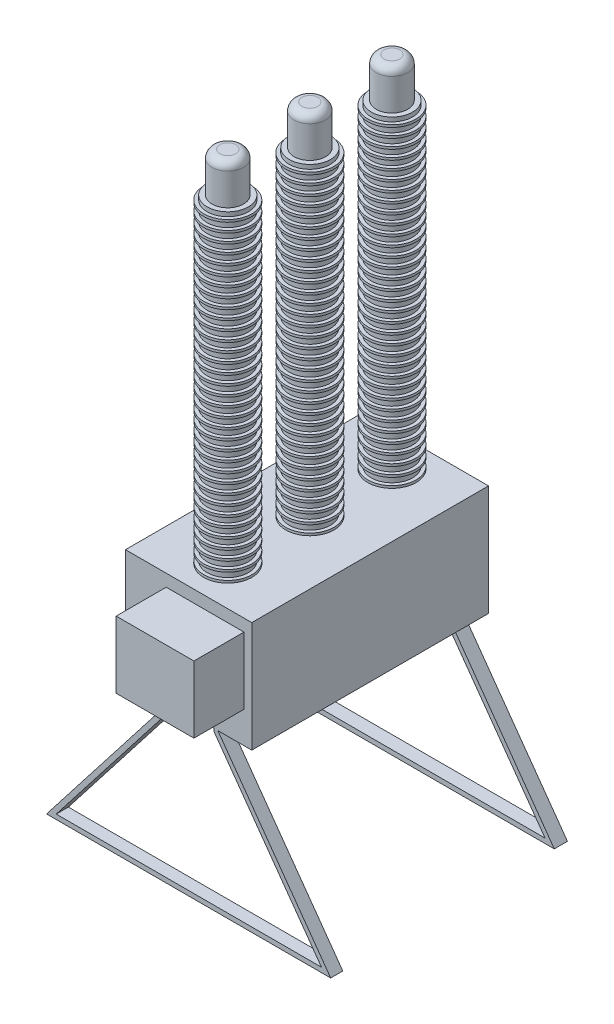
from build123d import *

# Parameters (mm, degrees)
CROQUIS1_W                   = 800
CROQUIS1_H                   = 700
SALIENTE_EXTRUIR1_DEPTH      = 1500
SALIENTE_EXTRUIR2_DEPTH      = 750
SALIENTE_EXTRUIR2_DEPTH_BACK = 750
CROQUIS3_W                   = 1339.710548783
CROQUIS3_H                   = 1169.731657549
CORTAR_EXTRUIR1_DEPTH        = 2289
CROQUIS4_W                   = 492.540642935
CROQUIS4_H                   = 423.584952924
SALIENTE_EXTRUIR3_DEPTH      = 317
CROQUIS5_R                   = 130.618166111
SALIENTE_EXTRUIR4_DEPTH      = 2022
CROQUIS6_R                   = 152.572790618
SALIENTE_EXTRUIR5_DEPTH      = 15
MATRIZL1_COUNT               = 34
MATRIZL1_PITCH               = 60
MATRIZL2_COPY_1_SKETCH_R     = 152.572790618
MATRIZL2_COPY_1_DEPTH        = 15
MATRIZL2_COPY_2_SKETCH_R     = 152.572790618
MATRIZL2_COPY_2_DEPTH        = 15
MATRIZL2_COPY_3_SKETCH_R     = 152.572790618
MATRIZL2_COPY_3_DEPTH        = 15
MATRIZL2_COPY_4_SKETCH_R     = 152.572790618
MATRIZL2_COPY_4_DEPTH        = 15
MATRIZL2_COPY_5_SKETCH_R     = 152.572790618
MATRIZL2_COPY_5_DEPTH        = 15
MATRIZL2_COPY_6_SKETCH_R     = 152.572790618
MATRIZL2_COPY_6_DEPTH        = 15
MATRIZL2_COPY_7_SKETCH_R     = 152.572790618
MATRIZL2_COPY_7_DEPTH        = 15
MATRIZL2_COPY_8_SKETCH_R     = 152.572790618
MATRIZL2_COPY_8_DEPTH        = 15
MATRIZL2_COPY_9_SKETCH_R     = 152.572790618
MATRIZL2_COPY_9_DEPTH        = 15
MATRIZL2_COPY_10_SKETCH_R    = 152.572790618
MATRIZL2_COPY_10_DEPTH       = 15
MATRIZL2_COPY_11_SKETCH_R    = 152.572790618
MATRIZL2_COPY_11_DEPTH       = 15
MATRIZL2_COPY_12_SKETCH_R    = 152.572790618
MATRIZL2_COPY_12_DEPTH       = 15
MATRIZL2_COPY_13_SKETCH_R    = 152.572790618
MATRIZL2_COPY_13_DEPTH       = 15
MATRIZL2_COPY_14_SKETCH_R    = 152.572790618
MATRIZL2_COPY_14_DEPTH       = 15
MATRIZL2_COPY_15_SKETCH_R    = 152.572790618
MATRIZL2_COPY_15_DEPTH       = 15
MATRIZL2_COPY_16_SKETCH_R    = 152.572790618
MATRIZL2_COPY_16_DEPTH       = 15
MATRIZL2_COPY_17_SKETCH_R    = 152.572790618
MATRIZL2_COPY_17_DEPTH       = 15
MATRIZL2_COPY_18_SKETCH_R    = 152.572790618
MATRIZL2_COPY_18_DEPTH       = 15
MATRIZL2_COPY_19_SKETCH_R    = 152.572790618
MATRIZL2_COPY_19_DEPTH       = 15
MATRIZL2_COPY_20_SKETCH_R    = 152.572790618
MATRIZL2_COPY_20_DEPTH       = 15
MATRIZL2_COPY_21_SKETCH_R    = 152.572790618
MATRIZL2_COPY_21_DEPTH       = 15
MATRIZL2_COPY_22_SKETCH_R    = 152.572790618
MATRIZL2_COPY_22_DEPTH       = 15
MATRIZL2_COPY_23_SKETCH_R    = 152.572790618
MATRIZL2_COPY_23_DEPTH       = 15
MATRIZL2_COPY_24_SKETCH_R    = 152.572790618
MATRIZL2_COPY_24_DEPTH       = 15
MATRIZL2_COPY_25_SKETCH_R    = 152.572790618
MATRIZL2_COPY_25_DEPTH       = 15
MATRIZL2_COPY_26_SKETCH_R    = 152.572790618
MATRIZL2_COPY_26_DEPTH       = 15
MATRIZL2_COPY_27_SKETCH_R    = 152.572790618
MATRIZL2_COPY_27_DEPTH       = 15
MATRIZL2_COPY_28_SKETCH_R    = 152.572790618
MATRIZL2_COPY_28_DEPTH       = 15
MATRIZL2_COPY_29_SKETCH_R    = 152.572790618
MATRIZL2_COPY_29_DEPTH       = 15
MATRIZL2_COPY_30_SKETCH_R    = 152.572790618
MATRIZL2_COPY_30_DEPTH       = 15
MATRIZL2_COPY_31_SKETCH_R    = 152.572790618
MATRIZL2_COPY_31_DEPTH       = 15
MATRIZL2_COPY_32_SKETCH_R    = 152.572790618
MATRIZL2_COPY_32_DEPTH       = 15
MATRIZL2_COPY_33_SKETCH_R    = 152.572790618
MATRIZL2_COPY_33_DEPTH       = 15
MATRIZL2_COPY_34_SKETCH_R    = 152.572790618
MATRIZL2_COPY_34_DEPTH       = 15
MATRIZL2_COPY_35_SKETCH_R    = 152.572790618
MATRIZL2_COPY_35_DEPTH       = 15
MATRIZL2_COPY_36_SKETCH_R    = 152.572790618
MATRIZL2_COPY_36_DEPTH       = 15
MATRIZL2_COPY_37_SKETCH_R    = 152.572790618
MATRIZL2_COPY_37_DEPTH       = 15
MATRIZL2_COPY_38_SKETCH_R    = 152.572790618
MATRIZL2_COPY_38_DEPTH       = 15
MATRIZL2_COPY_39_SKETCH_R    = 152.572790618
MATRIZL2_COPY_39_DEPTH       = 15
MATRIZL2_COPY_40_SKETCH_R    = 152.572790618
MATRIZL2_COPY_40_DEPTH       = 15
MATRIZL2_COPY_41_SKETCH_R    = 152.572790618
MATRIZL2_COPY_41_DEPTH       = 15
MATRIZL2_COPY_42_SKETCH_R    = 152.572790618
MATRIZL2_COPY_42_DEPTH       = 15
MATRIZL2_COPY_43_SKETCH_R    = 152.572790618
MATRIZL2_COPY_43_DEPTH       = 15
MATRIZL2_COPY_44_SKETCH_R    = 152.572790618
MATRIZL2_COPY_44_DEPTH       = 15
MATRIZL2_COPY_45_SKETCH_R    = 152.572790618
MATRIZL2_COPY_45_DEPTH       = 15
MATRIZL2_COPY_46_SKETCH_R    = 152.572790618
MATRIZL2_COPY_46_DEPTH       = 15
MATRIZL2_COPY_47_SKETCH_R    = 152.572790618
MATRIZL2_COPY_47_DEPTH       = 15
MATRIZL2_COPY_48_SKETCH_R    = 152.572790618
MATRIZL2_COPY_48_DEPTH       = 15
MATRIZL2_COPY_49_SKETCH_R    = 152.572790618
MATRIZL2_COPY_49_DEPTH       = 15
MATRIZL2_COPY_50_SKETCH_R    = 152.572790618
MATRIZL2_COPY_50_DEPTH       = 15
MATRIZL2_COPY_51_SKETCH_R    = 152.572790618
MATRIZL2_COPY_51_DEPTH       = 15
MATRIZL2_COPY_52_SKETCH_R    = 152.572790618
MATRIZL2_COPY_52_DEPTH       = 15
MATRIZL2_COPY_53_SKETCH_R    = 152.572790618
MATRIZL2_COPY_53_DEPTH       = 15
MATRIZL2_COPY_54_SKETCH_R    = 152.572790618
MATRIZL2_COPY_54_DEPTH       = 15
MATRIZL2_COPY_55_SKETCH_R    = 152.572790618
MATRIZL2_COPY_55_DEPTH       = 15
MATRIZL2_COPY_56_SKETCH_R    = 152.572790618
MATRIZL2_COPY_56_DEPTH       = 15
MATRIZL2_COPY_57_SKETCH_R    = 152.572790618
MATRIZL2_COPY_57_DEPTH       = 15
MATRIZL2_COPY_58_SKETCH_R    = 152.572790618
MATRIZL2_COPY_58_DEPTH       = 15
MATRIZL2_COPY_59_SKETCH_R    = 152.572790618
MATRIZL2_COPY_59_DEPTH       = 15
MATRIZL2_COPY_60_SKETCH_R    = 152.572790618
MATRIZL2_COPY_60_DEPTH       = 15
MATRIZL2_COPY_61_SKETCH_R    = 152.572790618
MATRIZL2_COPY_61_DEPTH       = 15
MATRIZL2_COPY_62_SKETCH_R    = 152.572790618
MATRIZL2_COPY_62_DEPTH       = 15
MATRIZL2_COPY_63_SKETCH_R    = 152.572790618
MATRIZL2_COPY_63_DEPTH       = 15
MATRIZL2_COPY_64_SKETCH_R    = 152.572790618
MATRIZL2_COPY_64_DEPTH       = 15
MATRIZL2_COPY_65_SKETCH_R    = 152.572790618
MATRIZL2_COPY_65_DEPTH       = 15
MATRIZL2_COPY_66_SKETCH_R    = 152.572790618
MATRIZL2_COPY_66_DEPTH       = 15
MATRIZL2_COPY_67_SKETCH_R    = 152.572790618
MATRIZL2_COPY_67_DEPTH       = 15
MATRIZL2_COPY_68_SKETCH_R    = 152.572790618
MATRIZL2_COPY_68_DEPTH       = 15
CROQUIS7_R                   = 99.942144547
SALIENTE_EXTRUIR6_DEPTH      = 251
REDONDEO1_R                  = 50
MATRIZL5_COUNT               = 3
MATRIZL5_PITCH               = 520
REDONDEO1_OF_MATRIZL5_R      = 50


with BuildPart() as part:
    # Croquis1 → Saliente-Extruir1 (new body)
    with BuildSketch(Plane.XY):
        Rectangle(CROQUIS1_W, CROQUIS1_H)
    extrude(amount=SALIENTE_EXTRUIR1_DEPTH)

    # Croquis2 → Saliente-Extruir2 (add, two sides: drawn at the far end of the back side and taken through both)
    with BuildSketch(Plane.XY.offset(750).offset(-SALIENTE_EXTRUIR2_DEPTH_BACK)):
        Polygon((-122.388599712, -350), (-900, -1350), (900, -1350), (185.24398067, -350), (160.837406754, -350), (160.837406754, -367.444745618), (841.682008568, -1320), (-838.668874661, -1320), (-98.706123821, -368.41576324), (-98.706123821, -350), align=None)
    extrude(amount=SALIENTE_EXTRUIR2_DEPTH + SALIENTE_EXTRUIR2_DEPTH_BACK)

    # Croquis3 → Cortar-Extruir1 (cut)
    with BuildSketch(Plane.ZY.offset(1150)):
        with Locations((753.260871839, -934.865828775)):
            Rectangle(CROQUIS3_W, CROQUIS3_H)
    extrude(amount=-CORTAR_EXTRUIR1_DEPTH, mode=Mode.SUBTRACT)

    # Croquis4 → Saliente-Extruir3 (add)
    with BuildSketch(Plane.XY.offset(1500)):
        with Locations((104.322614019, 61.323806272)):
            Rectangle(CROQUIS4_W, CROQUIS4_H)
    extrude(amount=SALIENTE_EXTRUIR3_DEPTH)

    # Croquis5 → Saliente-Extruir4 (add)
    with BuildSketch(Plane(origin=(0, 350, 0), x_dir=(1, 0, 0), z_dir=(0, 1, 0))):
        with Locations((0, -211.838823982)):
            Circle(CROQUIS5_R)
        with Locations((0, -731.838823982)):
            Circle(CROQUIS5_R)
        with Locations((0, -1251.838823982)):
            Circle(CROQUIS5_R)
    extrude(amount=SALIENTE_EXTRUIR4_DEPTH)

    # Croquis6 → Saliente-Extruir5 (add)
    with BuildSketch(Plane(origin=(0, 350, 0), x_dir=(1, 0, 0), z_dir=(0, 1, 0))):
        with Locations((0, -211.838823982)):
            Circle(CROQUIS6_R)
    saliente_extruir5 = extrude(amount=SALIENTE_EXTRUIR5_DEPTH)

    # MatrizL1: Saliente-Extruir5 ×34
    with Locations(*[(0, i * MATRIZL1_PITCH, 0) for i in range(1, MATRIZL1_COUNT)]):
        add(saliente_extruir5)

    # MatrizL2 copy 1 sketch → MatrizL2 copy 1 (add)
    with BuildSketch(Plane(origin=(0, 410, 520), x_dir=(1, 0, 0), z_dir=(0, 1, 0))):
        with Locations((0, -211.838823982)):
            Circle(MATRIZL2_COPY_1_SKETCH_R)
    extrude(amount=MATRIZL2_COPY_1_DEPTH)

    # MatrizL2 copy 2 sketch → MatrizL2 copy 2 (add)
    with BuildSketch(Plane(origin=(0, 410, 1040), x_dir=(1, 0, 0), z_dir=(0, 1, 0))):
        with Locations((0, -211.838823982)):
            Circle(MATRIZL2_COPY_2_SKETCH_R)
    extrude(amount=MATRIZL2_COPY_2_DEPTH)

    # MatrizL2 copy 3 sketch → MatrizL2 copy 3 (add)
    with BuildSketch(Plane(origin=(0, 470, 520), x_dir=(1, 0, 0), z_dir=(0, 1, 0))):
        with Locations((0, -211.838823982)):
            Circle(MATRIZL2_COPY_3_SKETCH_R)
    extrude(amount=MATRIZL2_COPY_3_DEPTH)

    # MatrizL2 copy 4 sketch → MatrizL2 copy 4 (add)
    with BuildSketch(Plane(origin=(0, 470, 1040), x_dir=(1, 0, 0), z_dir=(0, 1, 0))):
        with Locations((0, -211.838823982)):
            Circle(MATRIZL2_COPY_4_SKETCH_R)
    extrude(amount=MATRIZL2_COPY_4_DEPTH)

    # MatrizL2 copy 5 sketch → MatrizL2 copy 5 (add)
    with BuildSketch(Plane(origin=(0, 530, 520), x_dir=(1, 0, 0), z_dir=(0, 1, 0))):
        with Locations((0, -211.838823982)):
            Circle(MATRIZL2_COPY_5_SKETCH_R)
    extrude(amount=MATRIZL2_COPY_5_DEPTH)

    # MatrizL2 copy 6 sketch → MatrizL2 copy 6 (add)
    with BuildSketch(Plane(origin=(0, 530, 1040), x_dir=(1, 0, 0), z_dir=(0, 1, 0))):
        with Locations((0, -211.838823982)):
            Circle(MATRIZL2_COPY_6_SKETCH_R)
    extrude(amount=MATRIZL2_COPY_6_DEPTH)

    # MatrizL2 copy 7 sketch → MatrizL2 copy 7 (add)
    with BuildSketch(Plane(origin=(0, 590, 520), x_dir=(1, 0, 0), z_dir=(0, 1, 0))):
        with Locations((0, -211.838823982)):
            Circle(MATRIZL2_COPY_7_SKETCH_R)
    extrude(amount=MATRIZL2_COPY_7_DEPTH)

    # MatrizL2 copy 8 sketch → MatrizL2 copy 8 (add)
    with BuildSketch(Plane(origin=(0, 590, 1040), x_dir=(1, 0, 0), z_dir=(0, 1, 0))):
        with Locations((0, -211.838823982)):
            Circle(MATRIZL2_COPY_8_SKETCH_R)
    extrude(amount=MATRIZL2_COPY_8_DEPTH)

    # MatrizL2 copy 9 sketch → MatrizL2 copy 9 (add)
    with BuildSketch(Plane(origin=(0, 650, 520), x_dir=(1, 0, 0), z_dir=(0, 1, 0))):
        with Locations((0, -211.838823982)):
            Circle(MATRIZL2_COPY_9_SKETCH_R)
    extrude(amount=MATRIZL2_COPY_9_DEPTH)

    # MatrizL2 copy 10 sketch → MatrizL2 copy 10 (add)
    with BuildSketch(Plane(origin=(0, 650, 1040), x_dir=(1, 0, 0), z_dir=(0, 1, 0))):
        with Locations((0, -211.838823982)):
            Circle(MATRIZL2_COPY_10_SKETCH_R)
    extrude(amount=MATRIZL2_COPY_10_DEPTH)

    # MatrizL2 copy 11 sketch → MatrizL2 copy 11 (add)
    with BuildSketch(Plane(origin=(0, 710, 520), x_dir=(1, 0, 0), z_dir=(0, 1, 0))):
        with Locations((0, -211.838823982)):
            Circle(MATRIZL2_COPY_11_SKETCH_R)
    extrude(amount=MATRIZL2_COPY_11_DEPTH)

    # MatrizL2 copy 12 sketch → MatrizL2 copy 12 (add)
    with BuildSketch(Plane(origin=(0, 710, 1040), x_dir=(1, 0, 0), z_dir=(0, 1, 0))):
        with Locations((0, -211.838823982)):
            Circle(MATRIZL2_COPY_12_SKETCH_R)
    extrude(amount=MATRIZL2_COPY_12_DEPTH)

    # MatrizL2 copy 13 sketch → MatrizL2 copy 13 (add)
    with BuildSketch(Plane(origin=(0, 770, 520), x_dir=(1, 0, 0), z_dir=(0, 1, 0))):
        with Locations((0, -211.838823982)):
            Circle(MATRIZL2_COPY_13_SKETCH_R)
    extrude(amount=MATRIZL2_COPY_13_DEPTH)

    # MatrizL2 copy 14 sketch → MatrizL2 copy 14 (add)
    with BuildSketch(Plane(origin=(0, 770, 1040), x_dir=(1, 0, 0), z_dir=(0, 1, 0))):
        with Locations((0, -211.838823982)):
            Circle(MATRIZL2_COPY_14_SKETCH_R)
    extrude(amount=MATRIZL2_COPY_14_DEPTH)

    # MatrizL2 copy 15 sketch → MatrizL2 copy 15 (add)
    with BuildSketch(Plane(origin=(0, 830, 520), x_dir=(1, 0, 0), z_dir=(0, 1, 0))):
        with Locations((0, -211.838823982)):
            Circle(MATRIZL2_COPY_15_SKETCH_R)
    extrude(amount=MATRIZL2_COPY_15_DEPTH)

    # MatrizL2 copy 16 sketch → MatrizL2 copy 16 (add)
    with BuildSketch(Plane(origin=(0, 830, 1040), x_dir=(1, 0, 0), z_dir=(0, 1, 0))):
        with Locations((0, -211.838823982)):
            Circle(MATRIZL2_COPY_16_SKETCH_R)
    extrude(amount=MATRIZL2_COPY_16_DEPTH)

    # MatrizL2 copy 17 sketch → MatrizL2 copy 17 (add)
    with BuildSketch(Plane(origin=(0, 890, 520), x_dir=(1, 0, 0), z_dir=(0, 1, 0))):
        with Locations((0, -211.838823982)):
            Circle(MATRIZL2_COPY_17_SKETCH_R)
    extrude(amount=MATRIZL2_COPY_17_DEPTH)

    # MatrizL2 copy 18 sketch → MatrizL2 copy 18 (add)
    with BuildSketch(Plane(origin=(0, 890, 1040), x_dir=(1, 0, 0), z_dir=(0, 1, 0))):
        with Locations((0, -211.838823982)):
            Circle(MATRIZL2_COPY_18_SKETCH_R)
    extrude(amount=MATRIZL2_COPY_18_DEPTH)

    # MatrizL2 copy 19 sketch → MatrizL2 copy 19 (add)
    with BuildSketch(Plane(origin=(0, 950, 520), x_dir=(1, 0, 0), z_dir=(0, 1, 0))):
        with Locations((0, -211.838823982)):
            Circle(MATRIZL2_COPY_19_SKETCH_R)
    extrude(amount=MATRIZL2_COPY_19_DEPTH)

    # MatrizL2 copy 20 sketch → MatrizL2 copy 20 (add)
    with BuildSketch(Plane(origin=(0, 950, 1040), x_dir=(1, 0, 0), z_dir=(0, 1, 0))):
        with Locations((0, -211.838823982)):
            Circle(MATRIZL2_COPY_20_SKETCH_R)
    extrude(amount=MATRIZL2_COPY_20_DEPTH)

    # MatrizL2 copy 21 sketch → MatrizL2 copy 21 (add)
    with BuildSketch(Plane(origin=(0, 1010, 520), x_dir=(1, 0, 0), z_dir=(0, 1, 0))):
        with Locations((0, -211.838823982)):
            Circle(MATRIZL2_COPY_21_SKETCH_R)
    extrude(amount=MATRIZL2_COPY_21_DEPTH)

    # MatrizL2 copy 22 sketch → MatrizL2 copy 22 (add)
    with BuildSketch(Plane(origin=(0, 1010, 1040), x_dir=(1, 0, 0), z_dir=(0, 1, 0))):
        with Locations((0, -211.838823982)):
            Circle(MATRIZL2_COPY_22_SKETCH_R)
    extrude(amount=MATRIZL2_COPY_22_DEPTH)

    # MatrizL2 copy 23 sketch → MatrizL2 copy 23 (add)
    with BuildSketch(Plane(origin=(0, 1070, 520), x_dir=(1, 0, 0), z_dir=(0, 1, 0))):
        with Locations((0, -211.838823982)):
            Circle(MATRIZL2_COPY_23_SKETCH_R)
    extrude(amount=MATRIZL2_COPY_23_DEPTH)

    # MatrizL2 copy 24 sketch → MatrizL2 copy 24 (add)
    with BuildSketch(Plane(origin=(0, 1070, 1040), x_dir=(1, 0, 0), z_dir=(0, 1, 0))):
        with Locations((0, -211.838823982)):
            Circle(MATRIZL2_COPY_24_SKETCH_R)
    extrude(amount=MATRIZL2_COPY_24_DEPTH)

    # MatrizL2 copy 25 sketch → MatrizL2 copy 25 (add)
    with BuildSketch(Plane(origin=(0, 1130, 520), x_dir=(1, 0, 0), z_dir=(0, 1, 0))):
        with Locations((0, -211.838823982)):
            Circle(MATRIZL2_COPY_25_SKETCH_R)
    extrude(amount=MATRIZL2_COPY_25_DEPTH)

    # MatrizL2 copy 26 sketch → MatrizL2 copy 26 (add)
    with BuildSketch(Plane(origin=(0, 1130, 1040), x_dir=(1, 0, 0), z_dir=(0, 1, 0))):
        with Locations((0, -211.838823982)):
            Circle(MATRIZL2_COPY_26_SKETCH_R)
    extrude(amount=MATRIZL2_COPY_26_DEPTH)

    # MatrizL2 copy 27 sketch → MatrizL2 copy 27 (add)
    with BuildSketch(Plane(origin=(0, 1190, 520), x_dir=(1, 0, 0), z_dir=(0, 1, 0))):
        with Locations((0, -211.838823982)):
            Circle(MATRIZL2_COPY_27_SKETCH_R)
    extrude(amount=MATRIZL2_COPY_27_DEPTH)

    # MatrizL2 copy 28 sketch → MatrizL2 copy 28 (add)
    with BuildSketch(Plane(origin=(0, 1190, 1040), x_dir=(1, 0, 0), z_dir=(0, 1, 0))):
        with Locations((0, -211.838823982)):
            Circle(MATRIZL2_COPY_28_SKETCH_R)
    extrude(amount=MATRIZL2_COPY_28_DEPTH)

    # MatrizL2 copy 29 sketch → MatrizL2 copy 29 (add)
    with BuildSketch(Plane(origin=(0, 1250, 520), x_dir=(1, 0, 0), z_dir=(0, 1, 0))):
        with Locations((0, -211.838823982)):
            Circle(MATRIZL2_COPY_29_SKETCH_R)
    extrude(amount=MATRIZL2_COPY_29_DEPTH)

    # MatrizL2 copy 30 sketch → MatrizL2 copy 30 (add)
    with BuildSketch(Plane(origin=(0, 1250, 1040), x_dir=(1, 0, 0), z_dir=(0, 1, 0))):
        with Locations((0, -211.838823982)):
            Circle(MATRIZL2_COPY_30_SKETCH_R)
    extrude(amount=MATRIZL2_COPY_30_DEPTH)

    # MatrizL2 copy 31 sketch → MatrizL2 copy 31 (add)
    with BuildSketch(Plane(origin=(0, 1310, 520), x_dir=(1, 0, 0), z_dir=(0, 1, 0))):
        with Locations((0, -211.838823982)):
            Circle(MATRIZL2_COPY_31_SKETCH_R)
    extrude(amount=MATRIZL2_COPY_31_DEPTH)

    # MatrizL2 copy 32 sketch → MatrizL2 copy 32 (add)
    with BuildSketch(Plane(origin=(0, 1310, 1040), x_dir=(1, 0, 0), z_dir=(0, 1, 0))):
        with Locations((0, -211.838823982)):
            Circle(MATRIZL2_COPY_32_SKETCH_R)
    extrude(amount=MATRIZL2_COPY_32_DEPTH)

    # MatrizL2 copy 33 sketch → MatrizL2 copy 33 (add)
    with BuildSketch(Plane(origin=(0, 1370, 520), x_dir=(1, 0, 0), z_dir=(0, 1, 0))):
        with Locations((0, -211.838823982)):
            Circle(MATRIZL2_COPY_33_SKETCH_R)
    extrude(amount=MATRIZL2_COPY_33_DEPTH)

    # MatrizL2 copy 34 sketch → MatrizL2 copy 34 (add)
    with BuildSketch(Plane(origin=(0, 1370, 1040), x_dir=(1, 0, 0), z_dir=(0, 1, 0))):
        with Locations((0, -211.838823982)):
            Circle(MATRIZL2_COPY_34_SKETCH_R)
    extrude(amount=MATRIZL2_COPY_34_DEPTH)

    # MatrizL2 copy 35 sketch → MatrizL2 copy 35 (add)
    with BuildSketch(Plane(origin=(0, 1430, 520), x_dir=(1, 0, 0), z_dir=(0, 1, 0))):
        with Locations((0, -211.838823982)):
            Circle(MATRIZL2_COPY_35_SKETCH_R)
    extrude(amount=MATRIZL2_COPY_35_DEPTH)

    # MatrizL2 copy 36 sketch → MatrizL2 copy 36 (add)
    with BuildSketch(Plane(origin=(0, 1430, 1040), x_dir=(1, 0, 0), z_dir=(0, 1, 0))):
        with Locations((0, -211.838823982)):
            Circle(MATRIZL2_COPY_36_SKETCH_R)
    extrude(amount=MATRIZL2_COPY_36_DEPTH)

    # MatrizL2 copy 37 sketch → MatrizL2 copy 37 (add)
    with BuildSketch(Plane(origin=(0, 1490, 520), x_dir=(1, 0, 0), z_dir=(0, 1, 0))):
        with Locations((0, -211.838823982)):
            Circle(MATRIZL2_COPY_37_SKETCH_R)
    extrude(amount=MATRIZL2_COPY_37_DEPTH)

    # MatrizL2 copy 38 sketch → MatrizL2 copy 38 (add)
    with BuildSketch(Plane(origin=(0, 1490, 1040), x_dir=(1, 0, 0), z_dir=(0, 1, 0))):
        with Locations((0, -211.838823982)):
            Circle(MATRIZL2_COPY_38_SKETCH_R)
    extrude(amount=MATRIZL2_COPY_38_DEPTH)

    # MatrizL2 copy 39 sketch → MatrizL2 copy 39 (add)
    with BuildSketch(Plane(origin=(0, 1550, 520), x_dir=(1, 0, 0), z_dir=(0, 1, 0))):
        with Locations((0, -211.838823982)):
            Circle(MATRIZL2_COPY_39_SKETCH_R)
    extrude(amount=MATRIZL2_COPY_39_DEPTH)

    # MatrizL2 copy 40 sketch → MatrizL2 copy 40 (add)
    with BuildSketch(Plane(origin=(0, 1550, 1040), x_dir=(1, 0, 0), z_dir=(0, 1, 0))):
        with Locations((0, -211.838823982)):
            Circle(MATRIZL2_COPY_40_SKETCH_R)
    extrude(amount=MATRIZL2_COPY_40_DEPTH)

    # MatrizL2 copy 41 sketch → MatrizL2 copy 41 (add)
    with BuildSketch(Plane(origin=(0, 1610, 520), x_dir=(1, 0, 0), z_dir=(0, 1, 0))):
        with Locations((0, -211.838823982)):
            Circle(MATRIZL2_COPY_41_SKETCH_R)
    extrude(amount=MATRIZL2_COPY_41_DEPTH)

    # MatrizL2 copy 42 sketch → MatrizL2 copy 42 (add)
    with BuildSketch(Plane(origin=(0, 1610, 1040), x_dir=(1, 0, 0), z_dir=(0, 1, 0))):
        with Locations((0, -211.838823982)):
            Circle(MATRIZL2_COPY_42_SKETCH_R)
    extrude(amount=MATRIZL2_COPY_42_DEPTH)

    # MatrizL2 copy 43 sketch → MatrizL2 copy 43 (add)
    with BuildSketch(Plane(origin=(0, 1670, 520), x_dir=(1, 0, 0), z_dir=(0, 1, 0))):
        with Locations((0, -211.838823982)):
            Circle(MATRIZL2_COPY_43_SKETCH_R)
    extrude(amount=MATRIZL2_COPY_43_DEPTH)

    # MatrizL2 copy 44 sketch → MatrizL2 copy 44 (add)
    with BuildSketch(Plane(origin=(0, 1670, 1040), x_dir=(1, 0, 0), z_dir=(0, 1, 0))):
        with Locations((0, -211.838823982)):
            Circle(MATRIZL2_COPY_44_SKETCH_R)
    extrude(amount=MATRIZL2_COPY_44_DEPTH)

    # MatrizL2 copy 45 sketch → MatrizL2 copy 45 (add)
    with BuildSketch(Plane(origin=(0, 1730, 520), x_dir=(1, 0, 0), z_dir=(0, 1, 0))):
        with Locations((0, -211.838823982)):
            Circle(MATRIZL2_COPY_45_SKETCH_R)
    extrude(amount=MATRIZL2_COPY_45_DEPTH)

    # MatrizL2 copy 46 sketch → MatrizL2 copy 46 (add)
    with BuildSketch(Plane(origin=(0, 1730, 1040), x_dir=(1, 0, 0), z_dir=(0, 1, 0))):
        with Locations((0, -211.838823982)):
            Circle(MATRIZL2_COPY_46_SKETCH_R)
    extrude(amount=MATRIZL2_COPY_46_DEPTH)

    # MatrizL2 copy 47 sketch → MatrizL2 copy 47 (add)
    with BuildSketch(Plane(origin=(0, 1790, 520), x_dir=(1, 0, 0), z_dir=(0, 1, 0))):
        with Locations((0, -211.838823982)):
            Circle(MATRIZL2_COPY_47_SKETCH_R)
    extrude(amount=MATRIZL2_COPY_47_DEPTH)

    # MatrizL2 copy 48 sketch → MatrizL2 copy 48 (add)
    with BuildSketch(Plane(origin=(0, 1790, 1040), x_dir=(1, 0, 0), z_dir=(0, 1, 0))):
        with Locations((0, -211.838823982)):
            Circle(MATRIZL2_COPY_48_SKETCH_R)
    extrude(amount=MATRIZL2_COPY_48_DEPTH)

    # MatrizL2 copy 49 sketch → MatrizL2 copy 49 (add)
    with BuildSketch(Plane(origin=(0, 1850, 520), x_dir=(1, 0, 0), z_dir=(0, 1, 0))):
        with Locations((0, -211.838823982)):
            Circle(MATRIZL2_COPY_49_SKETCH_R)
    extrude(amount=MATRIZL2_COPY_49_DEPTH)

    # MatrizL2 copy 50 sketch → MatrizL2 copy 50 (add)
    with BuildSketch(Plane(origin=(0, 1850, 1040), x_dir=(1, 0, 0), z_dir=(0, 1, 0))):
        with Locations((0, -211.838823982)):
            Circle(MATRIZL2_COPY_50_SKETCH_R)
    extrude(amount=MATRIZL2_COPY_50_DEPTH)

    # MatrizL2 copy 51 sketch → MatrizL2 copy 51 (add)
    with BuildSketch(Plane(origin=(0, 1910, 520), x_dir=(1, 0, 0), z_dir=(0, 1, 0))):
        with Locations((0, -211.838823982)):
            Circle(MATRIZL2_COPY_51_SKETCH_R)
    extrude(amount=MATRIZL2_COPY_51_DEPTH)

    # MatrizL2 copy 52 sketch → MatrizL2 copy 52 (add)
    with BuildSketch(Plane(origin=(0, 1910, 1040), x_dir=(1, 0, 0), z_dir=(0, 1, 0))):
        with Locations((0, -211.838823982)):
            Circle(MATRIZL2_COPY_52_SKETCH_R)
    extrude(amount=MATRIZL2_COPY_52_DEPTH)

    # MatrizL2 copy 53 sketch → MatrizL2 copy 53 (add)
    with BuildSketch(Plane(origin=(0, 1970, 520), x_dir=(1, 0, 0), z_dir=(0, 1, 0))):
        with Locations((0, -211.838823982)):
            Circle(MATRIZL2_COPY_53_SKETCH_R)
    extrude(amount=MATRIZL2_COPY_53_DEPTH)

    # MatrizL2 copy 54 sketch → MatrizL2 copy 54 (add)
    with BuildSketch(Plane(origin=(0, 1970, 1040), x_dir=(1, 0, 0), z_dir=(0, 1, 0))):
        with Locations((0, -211.838823982)):
            Circle(MATRIZL2_COPY_54_SKETCH_R)
    extrude(amount=MATRIZL2_COPY_54_DEPTH)

    # MatrizL2 copy 55 sketch → MatrizL2 copy 55 (add)
    with BuildSketch(Plane(origin=(0, 2030, 520), x_dir=(1, 0, 0), z_dir=(0, 1, 0))):
        with Locations((0, -211.838823982)):
            Circle(MATRIZL2_COPY_55_SKETCH_R)
    extrude(amount=MATRIZL2_COPY_55_DEPTH)

    # MatrizL2 copy 56 sketch → MatrizL2 copy 56 (add)
    with BuildSketch(Plane(origin=(0, 2030, 1040), x_dir=(1, 0, 0), z_dir=(0, 1, 0))):
        with Locations((0, -211.838823982)):
            Circle(MATRIZL2_COPY_56_SKETCH_R)
    extrude(amount=MATRIZL2_COPY_56_DEPTH)

    # MatrizL2 copy 57 sketch → MatrizL2 copy 57 (add)
    with BuildSketch(Plane(origin=(0, 2090, 520), x_dir=(1, 0, 0), z_dir=(0, 1, 0))):
        with Locations((0, -211.838823982)):
            Circle(MATRIZL2_COPY_57_SKETCH_R)
    extrude(amount=MATRIZL2_COPY_57_DEPTH)

    # MatrizL2 copy 58 sketch → MatrizL2 copy 58 (add)
    with BuildSketch(Plane(origin=(0, 2090, 1040), x_dir=(1, 0, 0), z_dir=(0, 1, 0))):
        with Locations((0, -211.838823982)):
            Circle(MATRIZL2_COPY_58_SKETCH_R)
    extrude(amount=MATRIZL2_COPY_58_DEPTH)

    # MatrizL2 copy 59 sketch → MatrizL2 copy 59 (add)
    with BuildSketch(Plane(origin=(0, 2150, 520), x_dir=(1, 0, 0), z_dir=(0, 1, 0))):
        with Locations((0, -211.838823982)):
            Circle(MATRIZL2_COPY_59_SKETCH_R)
    extrude(amount=MATRIZL2_COPY_59_DEPTH)

    # MatrizL2 copy 60 sketch → MatrizL2 copy 60 (add)
    with BuildSketch(Plane(origin=(0, 2150, 1040), x_dir=(1, 0, 0), z_dir=(0, 1, 0))):
        with Locations((0, -211.838823982)):
            Circle(MATRIZL2_COPY_60_SKETCH_R)
    extrude(amount=MATRIZL2_COPY_60_DEPTH)

    # MatrizL2 copy 61 sketch → MatrizL2 copy 61 (add)
    with BuildSketch(Plane(origin=(0, 2210, 520), x_dir=(1, 0, 0), z_dir=(0, 1, 0))):
        with Locations((0, -211.838823982)):
            Circle(MATRIZL2_COPY_61_SKETCH_R)
    extrude(amount=MATRIZL2_COPY_61_DEPTH)

    # MatrizL2 copy 62 sketch → MatrizL2 copy 62 (add)
    with BuildSketch(Plane(origin=(0, 2210, 1040), x_dir=(1, 0, 0), z_dir=(0, 1, 0))):
        with Locations((0, -211.838823982)):
            Circle(MATRIZL2_COPY_62_SKETCH_R)
    extrude(amount=MATRIZL2_COPY_62_DEPTH)

    # MatrizL2 copy 63 sketch → MatrizL2 copy 63 (add)
    with BuildSketch(Plane(origin=(0, 2270, 520), x_dir=(1, 0, 0), z_dir=(0, 1, 0))):
        with Locations((0, -211.838823982)):
            Circle(MATRIZL2_COPY_63_SKETCH_R)
    extrude(amount=MATRIZL2_COPY_63_DEPTH)

    # MatrizL2 copy 64 sketch → MatrizL2 copy 64 (add)
    with BuildSketch(Plane(origin=(0, 2270, 1040), x_dir=(1, 0, 0), z_dir=(0, 1, 0))):
        with Locations((0, -211.838823982)):
            Circle(MATRIZL2_COPY_64_SKETCH_R)
    extrude(amount=MATRIZL2_COPY_64_DEPTH)

    # MatrizL2 copy 65 sketch → MatrizL2 copy 65 (add)
    with BuildSketch(Plane(origin=(0, 2330, 520), x_dir=(1, 0, 0), z_dir=(0, 1, 0))):
        with Locations((0, -211.838823982)):
            Circle(MATRIZL2_COPY_65_SKETCH_R)
    extrude(amount=MATRIZL2_COPY_65_DEPTH)

    # MatrizL2 copy 66 sketch → MatrizL2 copy 66 (add)
    with BuildSketch(Plane(origin=(0, 2330, 1040), x_dir=(1, 0, 0), z_dir=(0, 1, 0))):
        with Locations((0, -211.838823982)):
            Circle(MATRIZL2_COPY_66_SKETCH_R)
    extrude(amount=MATRIZL2_COPY_66_DEPTH)

    # MatrizL2 copy 67 sketch → MatrizL2 copy 67 (add)
    with BuildSketch(Plane(origin=(0, 350, 520), x_dir=(1, 0, 0), z_dir=(0, 1, 0))):
        with Locations((0, -211.838823982)):
            Circle(MATRIZL2_COPY_67_SKETCH_R)
    extrude(amount=MATRIZL2_COPY_67_DEPTH)

    # MatrizL2 copy 68 sketch → MatrizL2 copy 68 (add)
    with BuildSketch(Plane(origin=(0, 350, 1040), x_dir=(1, 0, 0), z_dir=(0, 1, 0))):
        with Locations((0, -211.838823982)):
            Circle(MATRIZL2_COPY_68_SKETCH_R)
    extrude(amount=MATRIZL2_COPY_68_DEPTH)

    # Croquis7 → Saliente-Extruir6 (add)
    with BuildSketch(Plane(origin=(0, 2372, 0), x_dir=(1, 0, 0), z_dir=(0, 1, 0))):
        with Locations((0, -211.838823982)):
            Circle(CROQUIS7_R)
    saliente_extruir6 = extrude(amount=SALIENTE_EXTRUIR6_DEPTH)

    # Redondeo1
    redondeo1_edges = [part.edges().sort_by_distance(p)[0] for p in [
        (-99.942144547, 2623, 211.838823982),
    ]]
    fillet(redondeo1_edges, radius=REDONDEO1_R)

    # MatrizL5: Saliente-Extruir6 ×3
    with Locations(*[(0, 0, i * MATRIZL5_PITCH) for i in range(1, MATRIZL5_COUNT)]):
        add(saliente_extruir6)

    # Redondeo1 of MatrizL5
    redondeo1_of_matrizl5_edges = [part.edges().sort_by_distance(p)[0] for p in [
        (-99.942144547, 2623, 731.838823982),
        (-99.942144547, 2623, 1251.838823982),
    ]]
    fillet(redondeo1_of_matrizl5_edges, radius=REDONDEO1_OF_MATRIZL5_R)


solid = part.part
